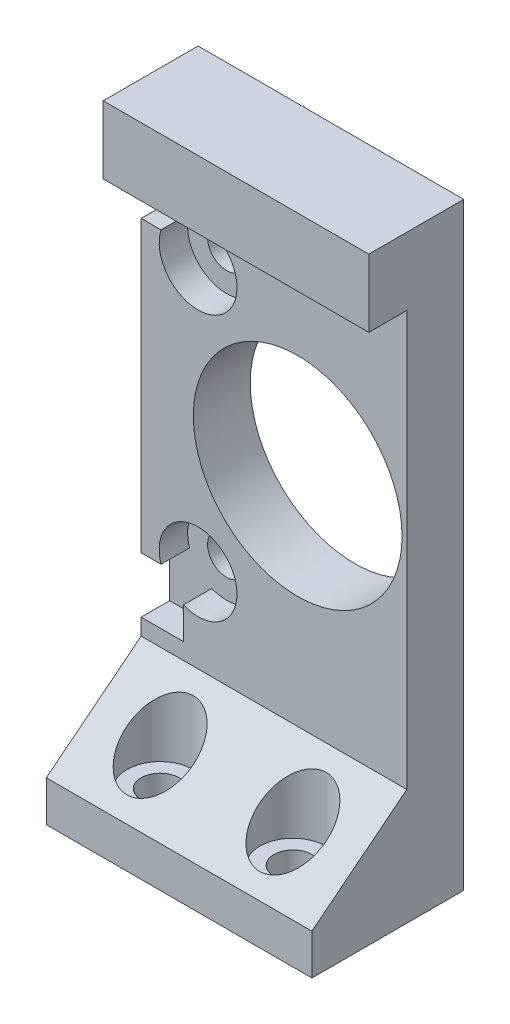
from build123d import *

# Parameters (mm, degrees)
SKETCH1_W            = 93
SKETCH1_H            = 100
BOSS_EXTRUDE2_DEPTH  = 10
SKETCH4_W            = 10.01
SKETCH4_H            = 15
BOSS_EXTRUDE4_DEPTH  = 24
SKETCH5_R            = 2
CUT_EXTRUDE1_DEPTH   = 50
SKETCH7_R            = 11
CUT_EXTRUDE3_DEPTH   = 50
SKETCH14_W           = 61.5
SKETCH14_H           = 42
CUT_EXTRUDE8_DEPTH   = 4
SKETCH19_R           = 11
CUT_EXTRUDE11_DEPTH  = 15
SKETCH20_R           = 2
CUT_EXTRUDE12_DEPTH  = 10
SKETCH21_W           = 40
SKETCH21_H           = 6
BOSS_EXTRUDE5_DEPTH  = 27
SKETCH22_W           = 40
SKETCH22_H           = 6.3
BOSS_EXTRUDE7_DEPTH  = 40
SKETCH23_R           = 8
CUT_EXTRUDE13_DEPTH  = 40
SKETCH24_W           = 118.277817783
SKETCH24_H           = 41.8
CUT_EXTRUDE14_DEPTH  = 40
SKETCH25_W           = 31.5
SKETCH25_H           = 23.2
CUT_EXTRUDE15_DEPTH  = 20
CUT_EXTRUDE18_DEPTH  = 3
SKETCH27_R           = 4.1
SKETCH27_R_2         = 4
CUT_EXTRUDE29_DEPTH  = 3
SKETCH28_W           = 29.5
SKETCH28_H           = 58.2
CUT_EXTRUDE30_DEPTH  = 23
SKETCH29_W           = 32
SKETCH29_H           = 4
CUT_EXTRUDE31_DEPTH  = 23
SKETCH31_W           = 32
SKETCH31_H           = 6
BOSS_EXTRUDE9_DEPTH  = 6.6
SKETCH32_W           = 32
SKETCH32_H           = 6
BOSS_EXTRUDE10_DEPTH = 10
SKETCH33_R           = 2
CUT_EXTRUDE32_DEPTH  = 10
BOSS_EXTRUDE11_START = -32
BOSS_EXTRUDE11_DEPTH = 32
SKETCH35_R           = 3.5
CUT_EXTRUDE33_DEPTH  = 10
SKETCH36_W           = 27
SKETCH36_H           = 46
CUT_EXTRUDE34_DEPTH  = 50
SKETCH38_W           = 31.75
SKETCH38_H           = 35
CUT_EXTRUDE35_DEPTH  = 50
SKETCH40_W           = 4
SKETCH40_H           = 77.818306413
CUT_EXTRUDE37_DEPTH  = 110
SKETCH41_W           = 28
SKETCH41_H           = 1.72
CUT_EXTRUDE38_DEPTH  = 50


with BuildPart() as part:
    # Sketch1 → Boss-Extrude2 (new body)
    with BuildSketch(Plane.XY):
        with Locations((-29.68705036, 14.928057554)):
            Rectangle(SKETCH1_W, SKETCH1_H)
    extrude(amount=BOSS_EXTRUDE2_DEPTH)

    # Sketch4 → Boss-Extrude4 (add)
    with BuildSketch(Plane(origin=(16.81294964, 0, 0), x_dir=(0, 0, -1), z_dir=(1, 0, 0))):
        with Locations((-4.995, -12.571942446)):
            Rectangle(SKETCH4_W, SKETCH4_H)
    extrude(amount=BOSS_EXTRUDE4_DEPTH)

    # Sketch5 → Cut-Extrude1 (cut)
    with BuildSketch(Plane(origin=(0, -5.071942446, 0), x_dir=(1, 0, 0), z_dir=(0, 1, 0))):
        with Locations(Location((26.81294964, -5, 0), (0, 0, 180))):
            Circle(SKETCH5_R)
    extrude(amount=-CUT_EXTRUDE1_DEPTH, mode=Mode.SUBTRACT)

    # Sketch7 → Cut-Extrude3 (cut)
    with BuildSketch(Plane(origin=(0, 0, 0), x_dir=(-1, 0, 0), z_dir=(0, 0, -1))):
        with Locations((24.18705036, 36.928057554)):
            Circle(SKETCH7_R)
    extrude(amount=-CUT_EXTRUDE3_DEPTH, mode=Mode.SUBTRACT)

    # Sketch14 → Cut-Extrude8 (cut)
    with BuildSketch(Plane.XY.offset(10)):
        with Locations((-13.93705036, 36.789132279)):
            Rectangle(SKETCH14_W, SKETCH14_H)
    extrude(amount=-CUT_EXTRUDE8_DEPTH, mode=Mode.SUBTRACT)

    # Sketch19 → Cut-Extrude11 (cut)
    with BuildSketch(Plane(origin=(0, 0, 0), x_dir=(-1, 0, 0), z_dir=(0, 0, -1))):
        with Locations((53.18705036, 36.928057554)):
            Circle(SKETCH19_R)
    extrude(amount=-CUT_EXTRUDE11_DEPTH, mode=Mode.SUBTRACT)

    # Sketch20 → Cut-Extrude12 (cut)
    with BuildSketch(Plane.XY.offset(6)):
        with Locations((-34.68705036, 50.928057554)):
            Circle(SKETCH20_R)
        with Locations((5.31294964, 50.928057554)):
            Circle(SKETCH20_R)
        with Locations((-34.68705036, 22.928057554)):
            Circle(SKETCH20_R)
        with Locations((5.31294964, 22.928057554)):
            Circle(SKETCH20_R)
    extrude(amount=-CUT_EXTRUDE12_DEPTH, mode=Mode.SUBTRACT)

    # Sketch21 → Boss-Extrude5 (add)
    with BuildSketch(Plane(origin=(0, 0, 0), x_dir=(-1, 0, 0), z_dir=(0, 0, -1))):
        with Locations((56.18705036, 61.928057554)):
            Rectangle(SKETCH21_W, SKETCH21_H)
    extrude(amount=BOSS_EXTRUDE5_DEPTH)

    # Sketch22 → Boss-Extrude7 (add)
    with BuildSketch(Plane.XZ.offset(-58.928057554)):
        with Locations((-56.18705036, -23.85)):
            Rectangle(SKETCH22_W, SKETCH22_H)
    extrude(amount=BOSS_EXTRUDE7_DEPTH)

    # Sketch23 → Cut-Extrude13 (cut)
    with BuildSketch(Plane.XY.offset(10)):
        with Locations((-53.18705036, 36.928057554)):
            Circle(SKETCH23_R)
    extrude(amount=-CUT_EXTRUDE13_DEPTH, mode=Mode.SUBTRACT)

    # Sketch24 → Cut-Extrude14 (cut)
    with BuildSketch(Plane.XY.offset(10)):
        with Locations((-17.048141468, -14.171942446)):
            Rectangle(SKETCH24_W, SKETCH24_H)
    extrude(amount=-CUT_EXTRUDE14_DEPTH, mode=Mode.SUBTRACT)

    # Sketch25 → Cut-Extrude15 (cut)
    with BuildSketch(Plane.XY.offset(10)):
        with Locations((-60.43705036, 18.328057554)):
            Rectangle(SKETCH25_W, SKETCH25_H)
    extrude(amount=-CUT_EXTRUDE15_DEPTH, mode=Mode.SUBTRACT)

    # Sketch26 → Cut-Extrude18 (cut)
    with BuildSketch(Plane.XY.offset(6)):
        with BuildLine():
            Line((14.30212304, 57.789132279), (6.863398886, 57.789132279))
            Line((6.863398886, 57.789132279), (6.863398886, 54.615347499))
            ThreePointArc((6.863398886, 54.615347499), (8.24773413, 53.645968516), (9.108195728, 52.191428892))
            Line((9.108195728, 52.191428892), (14.30212304, 52.191428892))
            Line((14.30212304, 52.191428892), (14.30212304, 57.789132279))
        make_face()
        with BuildLine():
            Line((6.863398886, 19.240767609), (6.863398886, 15.789132279))
            Line((6.863398886, 15.789132279), (14.30212304, 15.789132279))
            Line((14.30212304, 15.789132279), (14.30212304, 20.928057554))
            Line((14.30212304, 20.928057554), (8.777051255, 20.928057554))
            ThreePointArc((8.777051255, 20.928057554), (7.95835451, 19.927752057), (6.863398886, 19.240767609))
        make_face()
        with BuildLine():
            Line((-36.237499605, 57.789132279), (-44.68705036, 57.789132279))
            Line((-44.68705036, 57.789132279), (-44.68705036, 52.191428892))
            Line((-44.68705036, 52.191428892), (-38.482296447, 52.191428892))
            ThreePointArc((-38.482296447, 52.191428892), (-37.621834849, 53.645968516), (-36.237499605, 54.615347499))
            Line((-36.237499605, 54.615347499), (-36.237499605, 57.789132279))
        make_face()
        with BuildLine():
            Line((-44.68705036, 21.664686216), (-44.68705036, 15.789132279))
            Line((-44.68705036, 15.789132279), (-36.237499605, 15.789132279))
            Line((-36.237499605, 15.789132279), (-36.237499605, 19.240767609))
            ThreePointArc((-36.237499605, 19.240767609), (-37.621834849, 20.210146592), (-38.482296447, 21.664686216))
            Line((-38.482296447, 21.664686216), (-44.68705036, 21.664686216))
        make_face()
    extrude(amount=-CUT_EXTRUDE18_DEPTH, mode=Mode.SUBTRACT)

    # Sketch27 → Cut-Extrude29 (cut)
    with BuildSketch(Plane.XY.offset(6)):
        with Locations((5.31294964, 50.928057554)):
            Circle(SKETCH27_R)
        with Locations((5.31294964, 22.928057554)):
            Circle(SKETCH27_R_2)
        with Locations((-34.68705036, 50.928057554)):
            Circle(SKETCH27_R)
        with Locations((-34.68705036, 22.928057554)):
            Circle(SKETCH27_R)
    extrude(amount=-CUT_EXTRUDE29_DEPTH, mode=Mode.SUBTRACT)

    # Sketch28 → Cut-Extrude30 (cut)
    with BuildSketch(Plane(origin=(0, 0, 0), x_dir=(-1, 0, 0), z_dir=(0, 0, -1))):
        with Locations((-2.06294964, 35.828057554)):
            Rectangle(SKETCH28_W, SKETCH28_H)
    extrude(amount=-CUT_EXTRUDE30_DEPTH, mode=Mode.SUBTRACT)

    # Sketch29 → Cut-Extrude31 (cut)
    with BuildSketch(Plane(origin=(0, 15.789132279, 0), x_dir=(1, 0, 0), z_dir=(0, 1, 0))):
        with Locations((-28.68705036, -8)):
            Rectangle(SKETCH29_W, SKETCH29_H)
    extrude(amount=-CUT_EXTRUDE31_DEPTH, mode=Mode.SUBTRACT)

    # Sketch31 → Boss-Extrude9 (add)
    with BuildSketch(Plane.XZ.offset(-6.728057554)):
        with Locations((-28.68705036, 3)):
            Rectangle(SKETCH31_W, SKETCH31_H)
    extrude(amount=BOSS_EXTRUDE9_DEPTH)

    # Sketch32 → Boss-Extrude10 (add)
    with BuildSketch(Plane.XY.offset(6)):
        with Locations((-28.68705036, 3.128057554)):
            Rectangle(SKETCH32_W, SKETCH32_H)
    extrude(amount=BOSS_EXTRUDE10_DEPTH)

    # Sketch33 → Cut-Extrude32 (cut)
    with BuildSketch(Plane(origin=(0, 6.128057554, 0), x_dir=(1, 0, 0), z_dir=(0, 1, 0))):
        with Locations(Location((-33.68705036, -11, 0), (0, 0, 270))):
            Circle(SKETCH33_R)
        with Locations(Location((-19.68705036, -11, 0), (0, 0, 270))):
            Circle(SKETCH33_R)
    extrude(amount=-CUT_EXTRUDE32_DEPTH, mode=Mode.SUBTRACT)

    # Sketch34 → Boss-Extrude11 (add)
    with BuildSketch(Plane(origin=(-12.68705036, 0, 0), x_dir=(0, 0, -1), z_dir=(1, 0, 0)).offset(BOSS_EXTRUDE11_START)):
        Polygon((-16, 6.128057554), (-6, 6.128057554), (-6, 14.058360342), align=None)
    extrude(amount=BOSS_EXTRUDE11_DEPTH)

    # Sketch35 → Cut-Extrude33 (cut)
    with BuildSketch(Plane.XZ.offset(-6.128057554)):
        with Locations((-19.68705036, 11)):
            Circle(SKETCH35_R)
        with Locations((-33.68705036, 11)):
            Circle(SKETCH35_R)
    extrude(amount=-CUT_EXTRUDE33_DEPTH, mode=Mode.SUBTRACT)

    # Sketch36 → Cut-Extrude34 (cut)
    with BuildSketch(Plane(origin=(-36.18705036, 0, 0), x_dir=(0, 0, -1), z_dir=(1, 0, 0))):
        with Locations((13.5, 41.928057554)):
            Rectangle(SKETCH36_W, SKETCH36_H)
    extrude(amount=-CUT_EXTRUDE34_DEPTH, mode=Mode.SUBTRACT)

    # Sketch38 → Cut-Extrude35 (cut)
    with BuildSketch(Plane.XY.offset(10)):
        with Locations((-60.31205036, 47.428057554)):
            Rectangle(SKETCH38_W, SKETCH38_H)
    extrude(amount=-CUT_EXTRUDE35_DEPTH, mode=Mode.SUBTRACT)

    # Sketch40 → Cut-Extrude37 (cut)
    with BuildSketch(Plane.XY.offset(16)):
        with Locations((-42.68705036, 39.037210761)):
            Rectangle(SKETCH40_W, SKETCH40_H)
    extrude(amount=-CUT_EXTRUDE37_DEPTH, mode=Mode.SUBTRACT)

    # Sketch41 → Cut-Extrude38 (cut)
    with BuildSketch(Plane.XY.offset(16)):
        with Locations((-26.68705036, 0.988057554)):
            Rectangle(SKETCH41_W, SKETCH41_H)
    extrude(amount=-CUT_EXTRUDE38_DEPTH, mode=Mode.SUBTRACT)


solid = part.part
